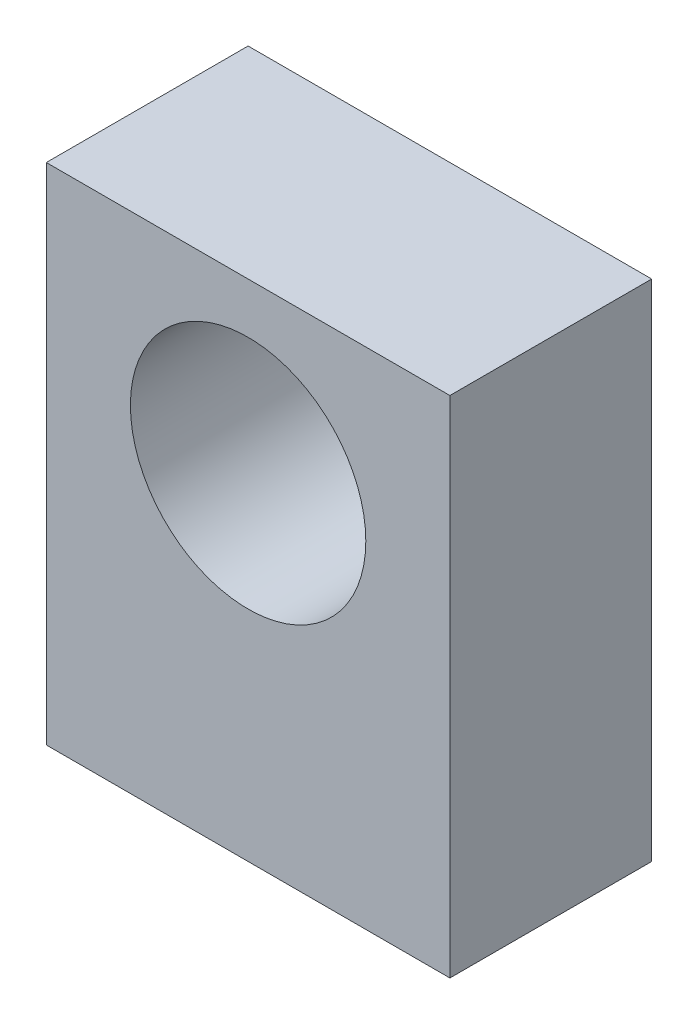
from build123d import *

# Parameters (mm, degrees)
SKETCH2_W           = 6
SKETCH2_H           = 7.5
SKETCH2_R           = 1.75
BOSS_EXTRUDE1_DEPTH = 3


with BuildPart() as part:
    # Sketch2 → Boss-Extrude1 (new body)
    with BuildSketch(Plane.XY):
        with Locations((-66.75, 46.5)):
            Rectangle(SKETCH2_W, SKETCH2_H)
        with Locations((-66.75, 47.75)):
            Circle(SKETCH2_R, mode=Mode.SUBTRACT)
    extrude(amount=BOSS_EXTRUDE1_DEPTH)


solid = part.part
